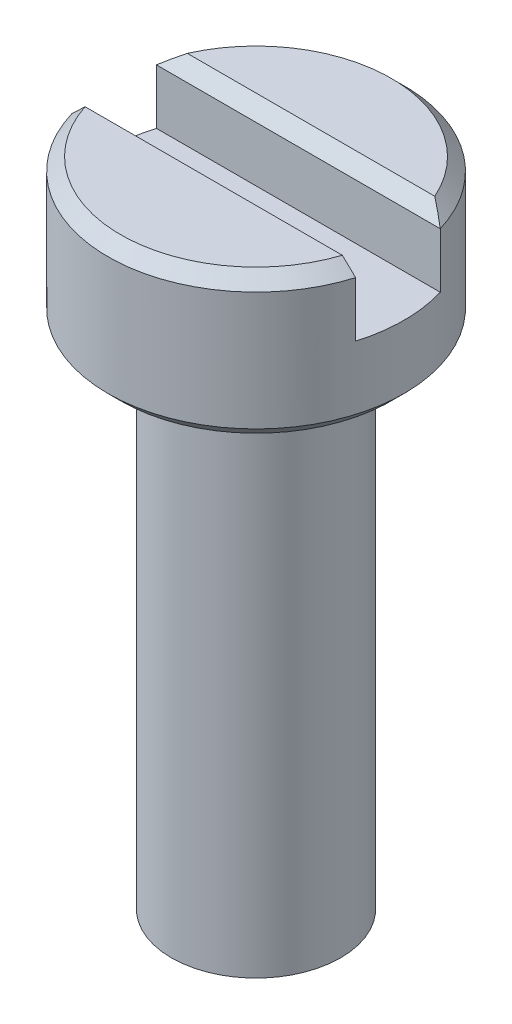
from build123d import *

# Parameters (mm, degrees)
SKETCH1_R           = 1.75
BOSS_EXTRUDE1_DEPTH = 1.7
SKETCH2_R           = 1
BOSS_EXTRUDE2_DEPTH = 6
SKETCH4_W           = 4
SKETCH4_H           = 1
CUT_EXTRUDE1_DEPTH  = 0.8
CHAMFER1_SIZE       = 0.15
FILLET1_R           = 0.2


with BuildPart() as part:
    # Sketch1 → Boss-Extrude1 (new body)
    with BuildSketch(Plane(origin=(0, 0, 0), x_dir=(1, 0, 0), z_dir=(0, 1, 0))):
        with Locations(Location((0, 0, 0), (0, 0, 270))):
            Circle(SKETCH1_R)
    extrude(amount=BOSS_EXTRUDE1_DEPTH)

    # Sketch2 → Boss-Extrude2 (add)
    with BuildSketch(Plane.XZ):
        with Locations(Location((0, 0, 0), (0, 0, 270))):
            Circle(SKETCH2_R)
    extrude(amount=BOSS_EXTRUDE2_DEPTH)

    # Sketch4 → Cut-Extrude1 (cut)
    with BuildSketch(Plane(origin=(0, 1.7, 0), x_dir=(1, 0, 0), z_dir=(0, 1, 0))):
        Rectangle(SKETCH4_W, SKETCH4_H)
    extrude(amount=-CUT_EXTRUDE1_DEPTH, mode=Mode.SUBTRACT)

    # Chamfer1
    chamfer1_edges = [part.edges().sort_by_distance(p)[0] for p in [
        (1.045825033, 1.7, 1.40312152),
        (0, 1.7, -0.5),
        (0, 0, -1.75),
        (0, 1.7, -1.75),
    ]]
    chamfer(chamfer1_edges, length=CHAMFER1_SIZE)

    # Fillet1
    fillet1_edges = [part.edges().sort_by_distance(p)[0] for p in [
        (0, 0, 1),
    ]]
    fillet(fillet1_edges, radius=FILLET1_R)


solid = part.part
